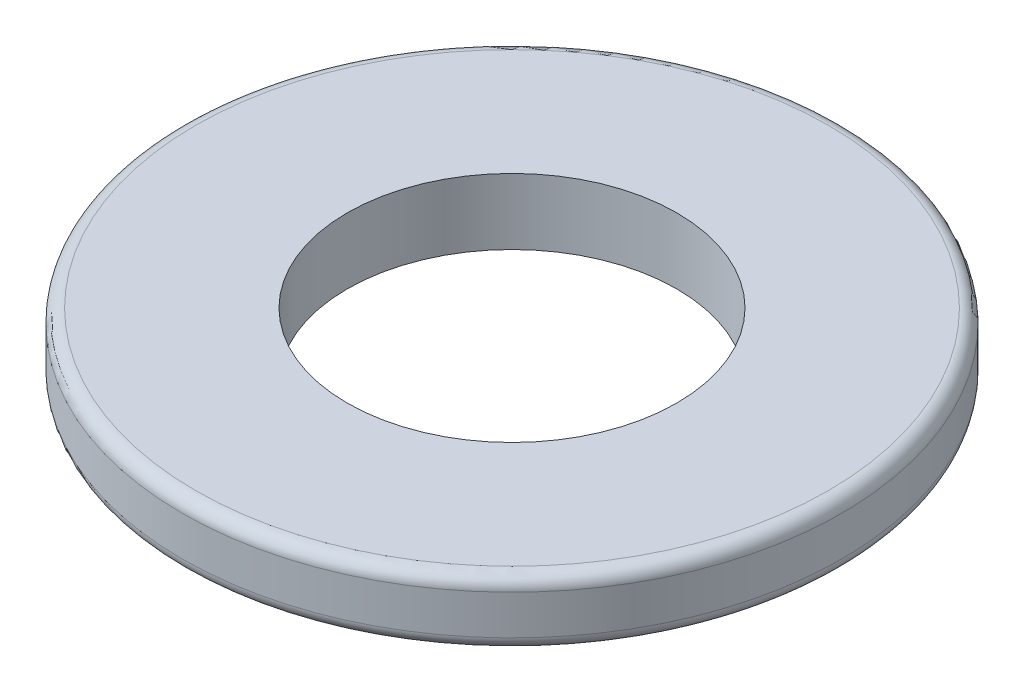
from build123d import *

# Parameters (mm, degrees)
SKETCH1_R           = 2.5
SKETCH1_R_2         = 1.25
BOSS_EXTRUDE1_DEPTH = 0.5
FILLET1_R           = 0.1


with BuildPart() as part:
    # Sketch1 → Boss-Extrude1 (new body)
    with BuildSketch(Plane(origin=(0, 0, 0), x_dir=(1, 0, 0), z_dir=(0, 1, 0))):
        with Locations(Location((0, 0, 0), (0, 0, 270))):
            Circle(SKETCH1_R)
        with Locations(Location((0, 0, 0), (0, 0, 270))):
            Circle(SKETCH1_R_2, mode=Mode.SUBTRACT)
    extrude(amount=BOSS_EXTRUDE1_DEPTH)

    # Fillet1
    fillet1_edges = [part.edges().sort_by_distance(p)[0] for p in [
        (0, 0, -2.5),
        (0, 0.5, -2.5),
    ]]
    fillet(fillet1_edges, radius=FILLET1_R)


solid = part.part
